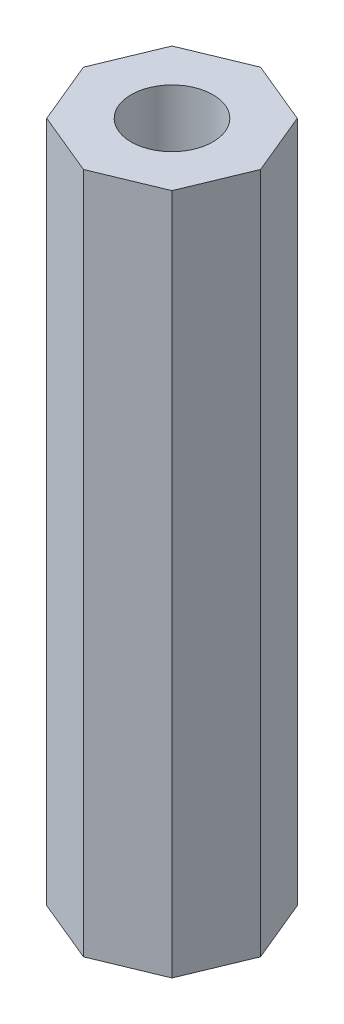
from build123d import *

# Parameters (mm, degrees)
SKETCH1_R           = 0.75
BOSS_EXTRUDE1_DEPTH = 12.5


with BuildPart() as part:
    # Sketch1 → Boss-Extrude1 (new body)
    with BuildSketch(Plane(origin=(0, 0, 0), x_dir=(1, 0, 0), z_dir=(0, 1, 0))):
        Polygon((1.6235883, 0), (1.148050297, 1.148050297), (0, 1.6235883), (-1.148050297, 1.148050297), (-1.6235883, 0), (-1.148050297, -1.148050297), (0, -1.6235883), (1.148050297, -1.148050297), align=None)
        with Locations(Location((0, 0, 0), (0, 0, 270))):
            Circle(SKETCH1_R, mode=Mode.SUBTRACT)
    extrude(amount=BOSS_EXTRUDE1_DEPTH)


solid = part.part
